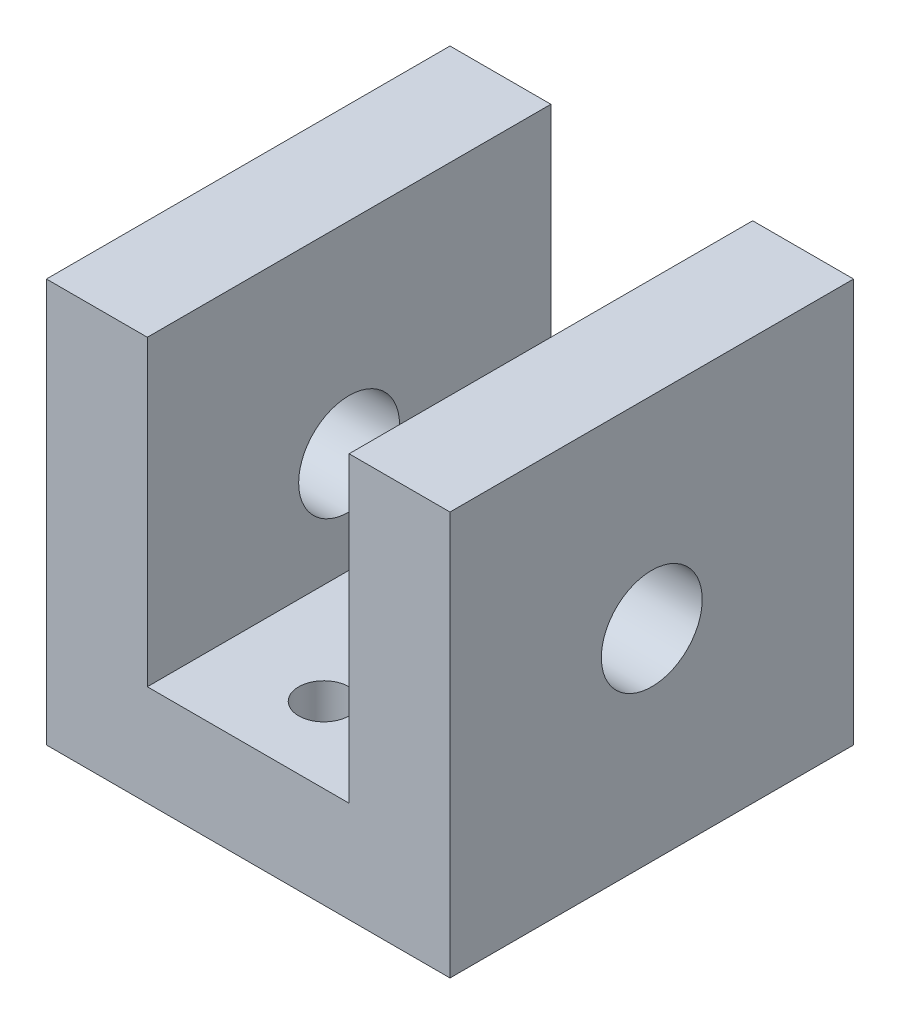
from build123d import *

# Parameters (mm, degrees)
EXTRUDE1_DEPTH     = 50.8
SKETCH2_R          = 3.175
CUT_EXTRUDE1_DEPTH = 88.988181024
SKETCH3_R          = 6.35
CUT_EXTRUDE2_DEPTH = 88.988181024


with BuildPart() as part:
    # Sketch1 → Extrude1 (new body)
    with BuildSketch(Plane.XY):
        Polygon((0, 0), (0, 50.8), (12.7, 50.8), (12.7, 12.7), (38.1, 12.7), (38.1, 50.8), (50.8, 50.8), (50.8, 0), align=None)
    extrude(amount=EXTRUDE1_DEPTH)

    # Sketch2 → Cut-Extrude1 (cut, through all)
    with BuildSketch(Plane.XZ):
        with Locations((25.4, 41.275)):
            Circle(SKETCH2_R)
        with Locations((25.4, 9.525)):
            Circle(SKETCH2_R)
    extrude(amount=-CUT_EXTRUDE1_DEPTH, mode=Mode.SUBTRACT)

    # Sketch3 → Cut-Extrude2 (cut, through all)
    with BuildSketch(Plane(origin=(50.8, 0, 0), x_dir=(0, 0, -1), z_dir=(1, 0, 0))):
        with Locations(Location((-25.4, 25.4, 0), (0, 0, 90))):
            Circle(SKETCH3_R)
    extrude(amount=-CUT_EXTRUDE2_DEPTH, mode=Mode.SUBTRACT)


solid = part.part
